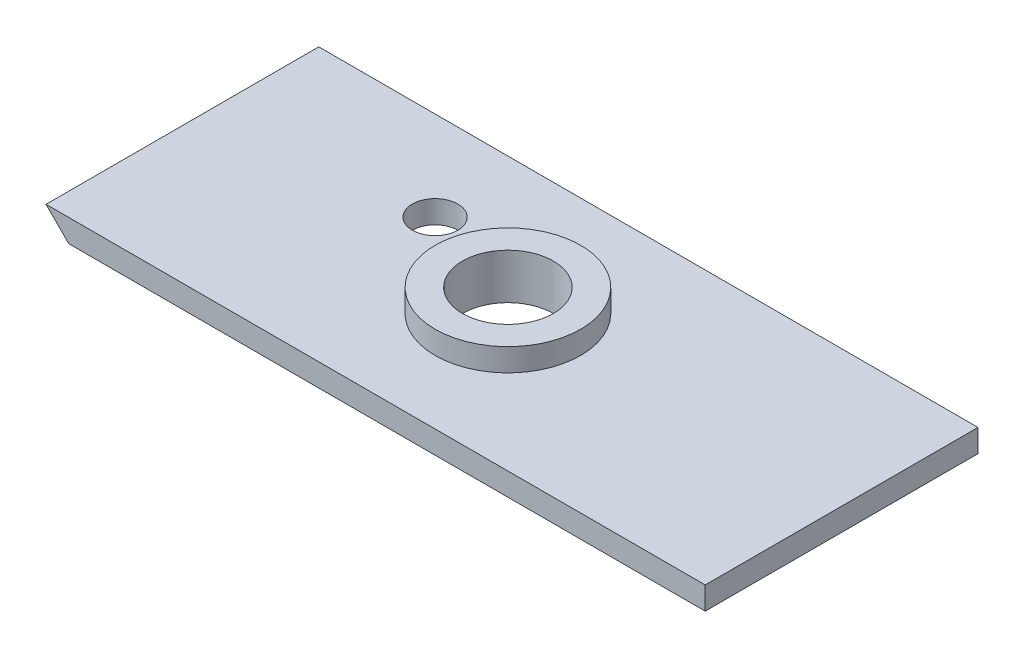
from build123d import *

# Parameters (mm, degrees)
SKETCH_2_W          = 30
SKETCH_2_H          = 12
SKETCH_2_R          = 2
EXTRUDE_1_DEPTH     = 1
SKETCH_3_R          = 3.2
SKETCH_3_R_2        = 2
EXTRUDE_2_DEPTH     = 1
SKETCH_4_R          = 1
CUT_EXTRUDE_1_DEPTH = 5
EXTRUDE_3_DEPTH     = 12
SKETCH_6_W          = 2
SKETCH_6_H          = 12
CUT_EXTRUDE_2_DEPTH = 1


with BuildPart() as part:
    # 草图2 → 凸台-拉伸1 (new body)
    with BuildSketch(Plane(origin=(0, 0, 0), x_dir=(1, 0, 0), z_dir=(0, 1, 0))):
        with Locations((-3.527606217, -1.94741871)):
            Rectangle(SKETCH_2_W, SKETCH_2_H)
        with Locations(Location((-5.207606217, -1.94741871, 0), (0, 0, 270))):
            Circle(SKETCH_2_R, mode=Mode.SUBTRACT)
    extrude(amount=EXTRUDE_1_DEPTH)

    # 草图3 → 凸台-拉伸2 (add)
    with BuildSketch(Plane(origin=(0, 1, 0), x_dir=(1, 0, 0), z_dir=(0, 1, 0))):
        with Locations(Location((-5.207606217, -1.94741871, 0), (0, 0, 270))):
            Circle(SKETCH_3_R)
        with Locations(Location((-5.207606217, -1.94741871, 0), (0, 0, 270))):
            Circle(SKETCH_3_R_2, mode=Mode.SUBTRACT)
    extrude(amount=EXTRUDE_2_DEPTH)

    # 草图4 → 切除-拉伸1 (cut)
    with BuildSketch(Plane.XZ):
        with Locations(Location((-10.481209657, -0.12271673, 0), (0, 0, 270))):
            Circle(SKETCH_4_R)
    extrude(amount=-CUT_EXTRUDE_1_DEPTH, mode=Mode.SUBTRACT)

    # 草图5 → 凸台-拉伸3 (add)
    with BuildSketch(Plane(origin=(0, 0, -4.05258129), x_dir=(-1, 0, 0), z_dir=(0, 0, -1))):
        Polygon((18.527606217, 1), (18.527606217, 0), (19.527606217, 1), align=None)
    extrude(amount=-EXTRUDE_3_DEPTH)

    # 草图6 → 切除-拉伸2 (cut)
    with BuildSketch(Plane.XZ):
        with Locations((10.472393783, 1.94741871)):
            Rectangle(SKETCH_6_W, SKETCH_6_H)
    extrude(amount=-CUT_EXTRUDE_2_DEPTH, mode=Mode.SUBTRACT)


solid = part.part
